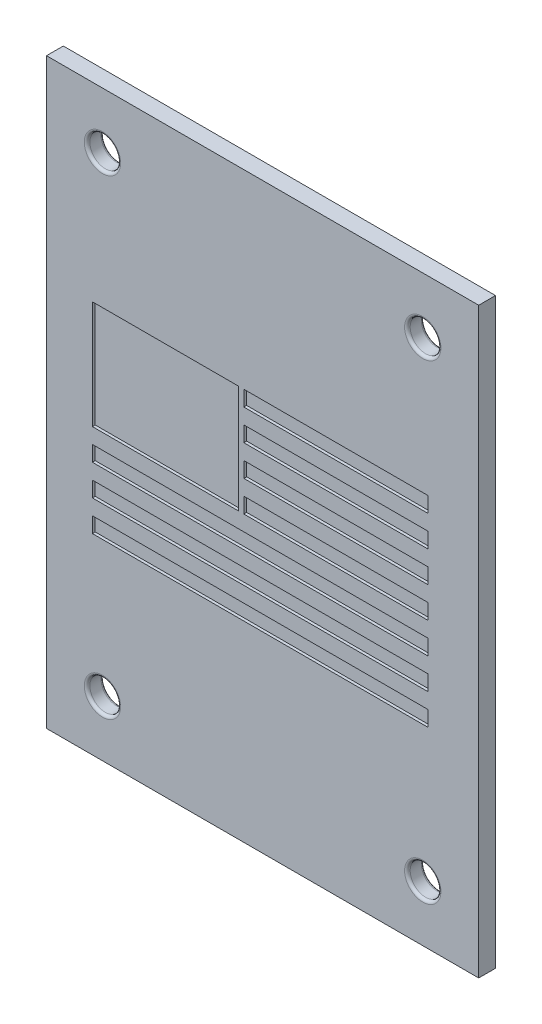
from build123d import *

# Parameters (mm, degrees)
SKETCH1_W           = 77.25
SKETCH1_H           = 104.14
BOSS_EXTRUDE1_DEPTH = 3
SKETCH2_R           = 2.75
CUT_EXTRUDE1_DEPTH  = 65.901275219
SKETCH7_W           = 32.924503251
SKETCH7_H           = 2.76
SKETCH7_W_2         = 60
CUT_EXTRUDE7_DEPTH  = 0.5
FILLET1_R           = 0.5


with BuildPart() as part:
    # Sketch1 → Boss-Extrude1 (new body)
    with BuildSketch(Plane.XY):
        Rectangle(SKETCH1_W, SKETCH1_H)
    extrude(amount=BOSS_EXTRUDE1_DEPTH)

    # Sketch2 → Cut-Extrude1 (cut, through all)
    with BuildSketch(Plane.XY.offset(3)):
        with Locations((-28.625, 42.07)):
            Circle(SKETCH2_R)
        with Locations(Location((28.625, 42.07, 0), (0, 0, 180))):
            Circle(SKETCH2_R)
        with Locations((28.625, -42.07)):
            Circle(SKETCH2_R)
        with Locations(Location((-28.625, -42.07, 0), (0, 0, 180))):
            Circle(SKETCH2_R)
    extrude(amount=-CUT_EXTRUDE1_DEPTH, mode=Mode.SUBTRACT)

    # Sketch7 → Cut-Extrude7 (cut)
    with BuildSketch(Plane.XY.offset(3)):
        Polygon((-4.353356397, 18.079518968), (-30.428853146, 18.079518968), (-30.428853146, -1.240481032), (-4.353356397, -1.240481032), (-4.353356397, 1.519518968), (-4.353356397, 4.279518968), (-4.353356397, 7.039518968), (-4.353356397, 9.799518968), (-4.353356397, 12.559518968), (-4.353356397, 15.319518968), align=None)
        with Locations((13.108895229, 16.699518968)):
            Rectangle(SKETCH7_W, SKETCH7_H)
        with Locations((13.108895229, 11.179518968)):
            Rectangle(SKETCH7_W, SKETCH7_H)
        with Locations((13.108895229, 5.659518968)):
            Rectangle(SKETCH7_W, SKETCH7_H)
        with Locations((13.108895229, 0.139518968)):
            Rectangle(SKETCH7_W, SKETCH7_H)
        with Locations((-0.428853146, -5.380481032)):
            Rectangle(SKETCH7_W_2, SKETCH7_H)
        with Locations((-0.428853146, -10.900481032)):
            Rectangle(SKETCH7_W_2, SKETCH7_H)
        with Locations((-0.428853146, -16.420481032)):
            Rectangle(SKETCH7_W_2, SKETCH7_H)
    extrude(amount=-CUT_EXTRUDE7_DEPTH, mode=Mode.SUBTRACT)

    # Fillet1
    fillet1_edges = [part.edges().sort_by_distance(p)[0] for p in [
        (-25.875, -42.07, 0),
        (-25.875, -42.07, 3),
        (25.875, -42.07, 0),
        (25.875, -42.07, 3),
        (31.375, 42.07, 0),
        (31.375, 42.07, 3),
        (-31.375, 42.07, 0),
        (-31.375, 42.07, 3),
    ]]
    fillet(fillet1_edges, radius=FILLET1_R)


solid = part.part
